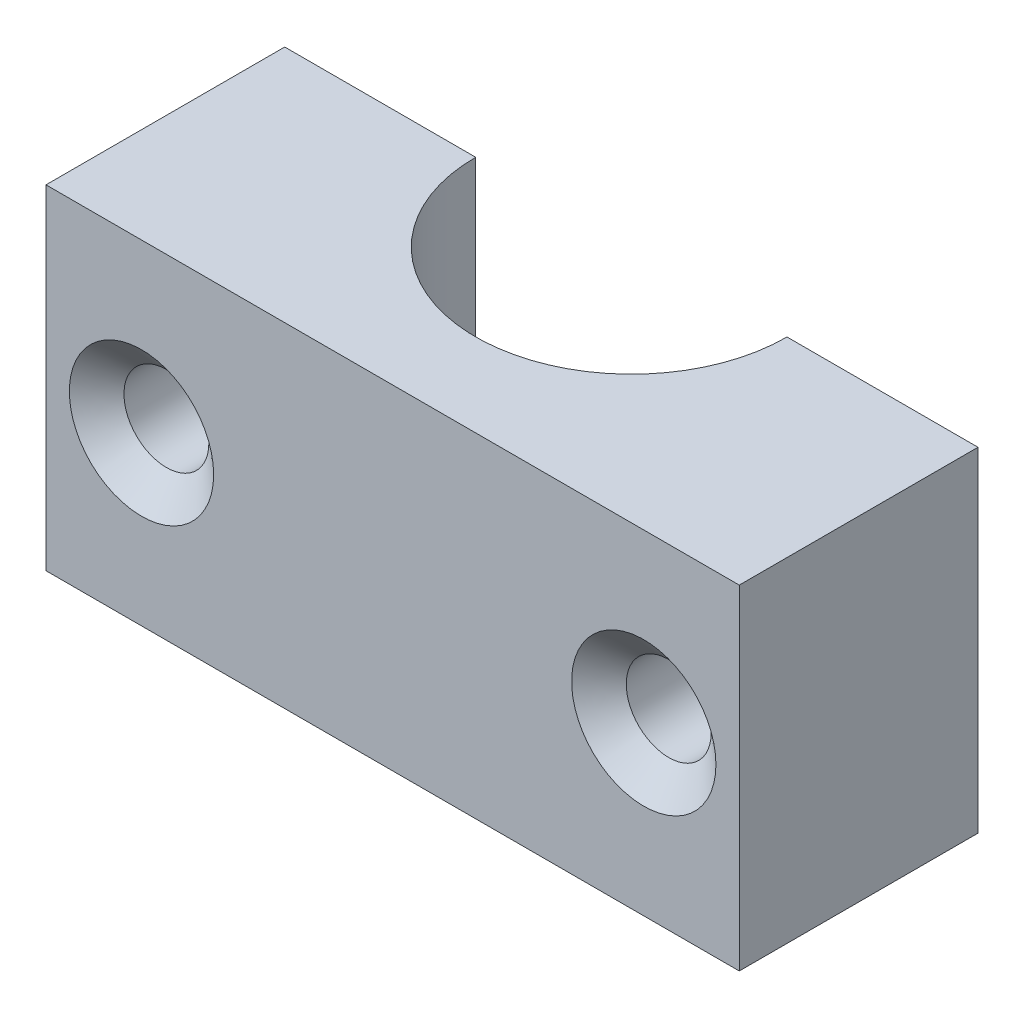
from build123d import *

# Parameters (mm, degrees)
BOSS_EXTRUDE1_DEPTH                               = 7
CSK_FOR_0_FLAT_HEAD_MACHINE_SCREW_100_D           = 1.778
CSK_FOR_0_FLAT_HEAD_MACHINE_SCREW_100_CSINK_D     = 3.0226
CSK_FOR_0_FLAT_HEAD_MACHINE_SCREW_100_CSINK_ANGLE = 100


with BuildPart() as part:
    # Sketch1 → Boss-Extrude1 (new body)
    with BuildSketch(Plane(origin=(0, 0, 0), x_dir=(1, 0, 0), z_dir=(0, 1, 0))):
        with BuildLine():
            Line((-7.26, 0), (-3.26, 0))
            ThreePointArc((-3.26, 0), (0, -3.26), (3.26, 0))
            Line((3.26, 0), (7.26, 0))
            Line((7.26, 0), (7.26, -5))
            Line((7.26, -5), (-7.26, -5))
            Line((-7.26, -5), (-7.26, 0))
        make_face()
    extrude(amount=BOSS_EXTRUDE1_DEPTH)

    # CSK for #0 Flat Head Machine Screw (100)1 (through all)
    with Locations(Plane.XY.offset(5)):
        with Locations((-5.26, 3.5), (5.26, 3.5)):
            CounterSinkHole(CSK_FOR_0_FLAT_HEAD_MACHINE_SCREW_100_D / 2, CSK_FOR_0_FLAT_HEAD_MACHINE_SCREW_100_CSINK_D / 2, counter_sink_angle=CSK_FOR_0_FLAT_HEAD_MACHINE_SCREW_100_CSINK_ANGLE)


solid = part.part
